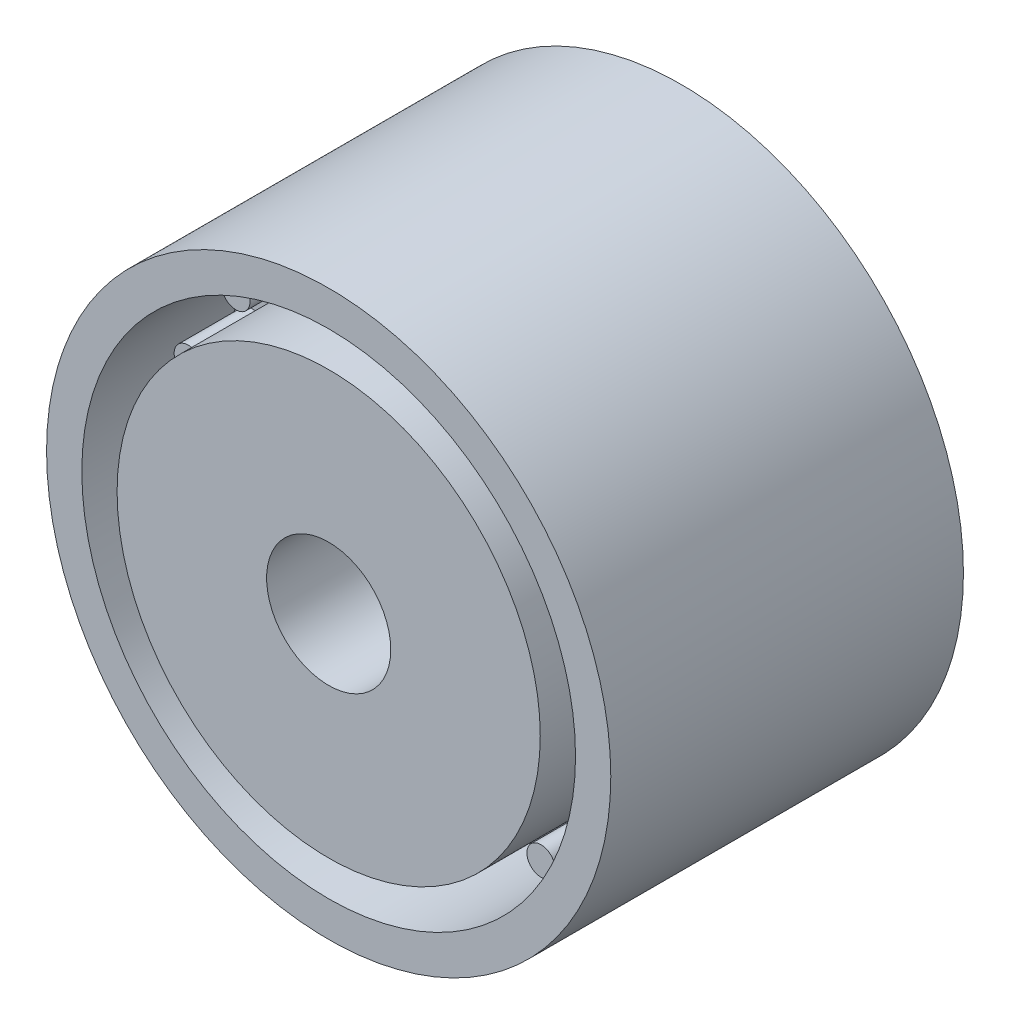
from build123d import *

# Parameters (mm, degrees)
SKETCH1_R           = 20
BOSS_EXTRUDE1_DEPTH = 25
SKETCH2_R           = 17.5
SKETCH2_R_2         = 15
CUT_EXTRUDE1_DEPTH  = 10
SKETCH3_R           = 4.4
CUT_EXTRUDE2_DEPTH  = 7
SKETCH4_R           = 12.5
CUT_EXTRUDE3_DEPTH  = 5
SKETCH5_R           = 1
BOSS_EXTRUDE2_DEPTH = 4.5


with BuildPart() as part:
    # Sketch1 → Boss-Extrude1 (new body)
    with BuildSketch(Plane.XY):
        Circle(SKETCH1_R)
    extrude(amount=-BOSS_EXTRUDE1_DEPTH)

    # Sketch2 → Cut-Extrude1 (cut)
    with BuildSketch(Plane.XY):
        Circle(SKETCH2_R)
        Circle(SKETCH2_R_2, mode=Mode.SUBTRACT)
    extrude(amount=-CUT_EXTRUDE1_DEPTH, mode=Mode.SUBTRACT)

    # Sketch3 → Cut-Extrude2 (cut)
    with BuildSketch(Plane.XY):
        Circle(SKETCH3_R)
    extrude(amount=-CUT_EXTRUDE2_DEPTH, mode=Mode.SUBTRACT)

    # Sketch4 → Cut-Extrude3 (cut)
    with BuildSketch(Plane(origin=(0, 0, -25), x_dir=(-1, 0, 0), z_dir=(0, 0, -1))):
        Circle(SKETCH4_R)
    extrude(amount=-CUT_EXTRUDE3_DEPTH, mode=Mode.SUBTRACT)

    # Sketch5 → Boss-Extrude2 (add)
    with BuildSketch(Plane.XY.offset(-10)):
        with Locations((0, 16.25)):
            Circle(SKETCH5_R)
        with Locations((6.60947045, 14.845113687)):
            Circle(SKETCH5_R)
        with Locations((12.076103414, 10.873372353)):
            Circle(SKETCH5_R)
        with Locations((15.45466839, 5.021526159)):
            Circle(SKETCH5_R)
        with Locations((16.1609808, -1.698587528)):
            Circle(SKETCH5_R)
        with Locations((14.072912811, -8.125)):
            Circle(SKETCH5_R)
        with Locations((9.55151035, -13.146526159)):
            Circle(SKETCH5_R)
        with Locations((3.378564976, -15.894898512)):
            Circle(SKETCH5_R)
        with Locations((-3.378564976, -15.894898512)):
            Circle(SKETCH5_R)
        with Locations((-9.55151035, -13.146526159)):
            Circle(SKETCH5_R)
        with Locations((-14.072912811, -8.125)):
            Circle(SKETCH5_R)
        with Locations((-16.1609808, -1.698587528)):
            Circle(SKETCH5_R)
        with Locations((-15.45466839, 5.021526159)):
            Circle(SKETCH5_R)
        with Locations((-12.076103414, 10.873372353)):
            Circle(SKETCH5_R)
        with Locations((-6.60947045, 14.845113687)):
            Circle(SKETCH5_R)
    extrude(amount=BOSS_EXTRUDE2_DEPTH)


solid = part.part
